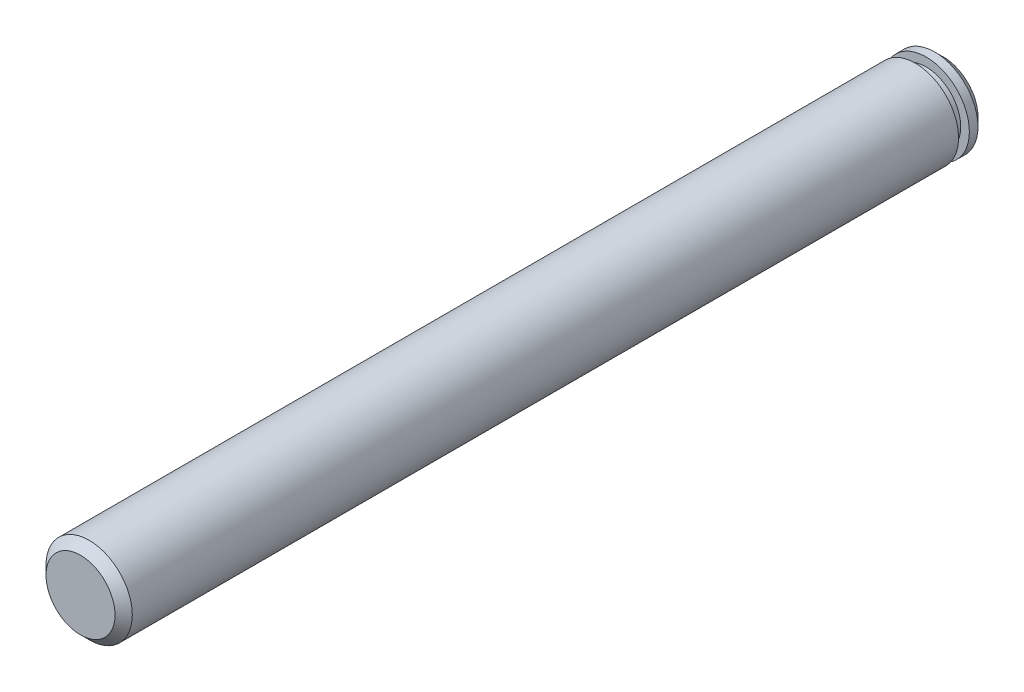
from build123d import *

# Parameters (mm, degrees)
SKETCH1_R           = 6.35
BOSS_EXTRUDE1_DEPTH = 127
CHAMFER1_SIZE       = 1.27
SKETCH2_W           = 6.845314317
SKETCH2_H           = 1.5875


with BuildPart() as part:
    # Sketch1 → Boss-Extrude1 (new body)
    with BuildSketch(Plane.XY):
        Circle(SKETCH1_R)
    extrude(amount=BOSS_EXTRUDE1_DEPTH)

    # Chamfer1
    chamfer1_edges = [part.edges().sort_by_distance(p)[0] for p in [
        (-6.35, 0, 0),
        (-6.35, 0, 127),
    ]]
    chamfer(chamfer1_edges, length=CHAMFER1_SIZE)

    # Sketch2 → Cut-Revolve1 (revolve, cut)
    with BuildSketch(Plane(origin=(0, 0, 0), x_dir=(1, 0, 0), z_dir=(0, 1, 0)), mode=Mode.PRIVATE) as cut_revolve1_sk:
        with Locations((8.502657158, -3.33375)):
            Rectangle(SKETCH2_W, SKETCH2_H)
    revolve(cut_revolve1_sk.sketch.rotate(Axis((0, 0, 0), (0, 0, 1)), 180), axis=Axis((0, 0, 0), (0, 0, 1)), mode=Mode.SUBTRACT)


solid = part.part
